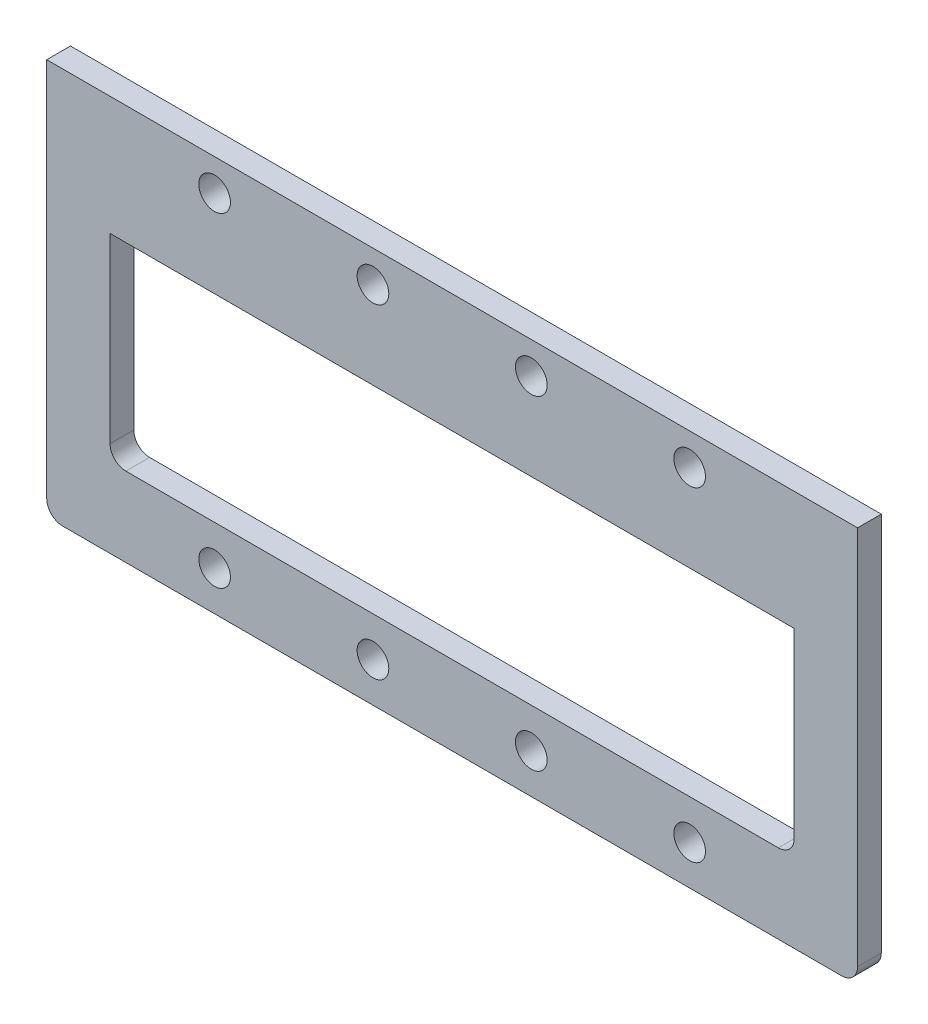
from build123d import *

# Parameters (mm, degrees)
SKETCH1_W               = 86.4
SKETCH1_H               = 25
BOSS_EXTRUDE1_DEPTH     = 3
CUT_EXTRUDE2_DEPTH      = 58.935016495
CUT_EXTRUDE2_DEPTH_BACK = 58.935016495
SKETCH2_R               = 2
FILLET1_R               = 2


with BuildPart() as part:
    # Sketch1 → Boss-Extrude1 (new body)
    with BuildSketch(Plane.XY):
        Polygon((-50.636338419, 24.154507628), (-50.636338419, 18.154507628), (-50.636338419, 16.154507628), (-50.636338419, -25.845492372), (51.763661581, -25.845492372), (51.763661581, 16.154507628), (51.763661581, 18.154507628), (51.763661581, 24.154507628), align=None)
        with Locations((0.563661581, -3.345492372)):
            Rectangle(SKETCH1_W, SKETCH1_H, mode=Mode.SUBTRACT)
    extrude(amount=BOSS_EXTRUDE1_DEPTH)

    # Sketch2 → Cut-Extrude2 (cut, two sides: drawn at the far end of the back side and taken through both)
    with BuildSketch(Plane.XY.offset(3).offset(-CUT_EXTRUDE2_DEPTH_BACK)):
        with Locations((-29.436338419, 20.154507628)):
            Circle(SKETCH2_R)
        with Locations((-29.436338419, -20.845492372)):
            Circle(SKETCH2_R)
        with Locations((-9.436338419, -20.845492372)):
            Circle(SKETCH2_R)
        with Locations((-9.436338419, 20.154507628)):
            Circle(SKETCH2_R)
        with Locations((10.563661581, -20.845492372)):
            Circle(SKETCH2_R)
        with Locations((10.563661581, 20.154507628)):
            Circle(SKETCH2_R)
        with Locations((30.563661581, -20.845492372)):
            Circle(SKETCH2_R)
        with Locations((30.563661581, 20.154507628)):
            Circle(SKETCH2_R)
    extrude(amount=CUT_EXTRUDE2_DEPTH + CUT_EXTRUDE2_DEPTH_BACK, mode=Mode.SUBTRACT)

    # Fillet1
    fillet1_edges = [part.edges().sort_by_distance(p)[0] for p in [
        (51.763661581, -25.845492372, 1.5),
        (-50.636338419, -25.845492372, 1.5),
        (-42.636338419, -15.845492372, 1.5),
        (43.763661581, -15.845492372, 1.5),
    ]]
    fillet(fillet1_edges, radius=FILLET1_R)


solid = part.part
